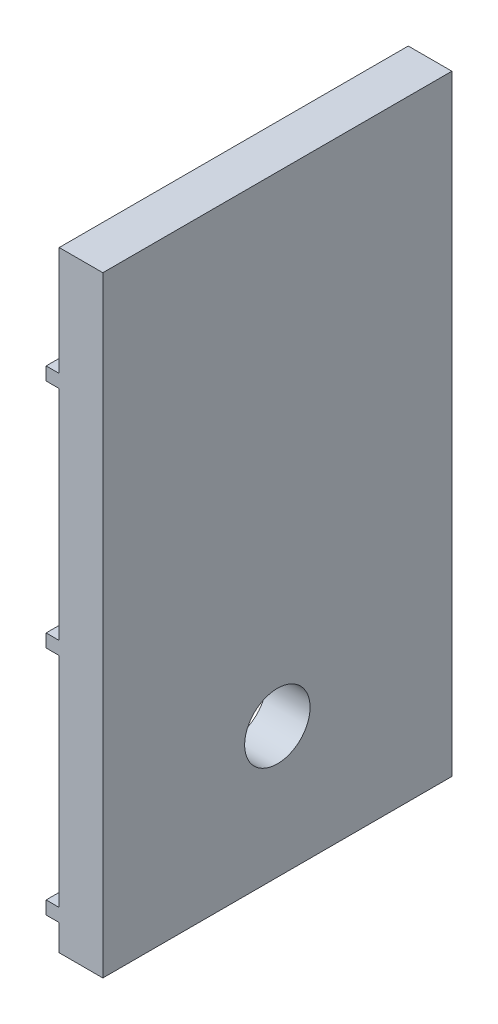
from build123d import *

# Parameters (mm, degrees)
BOSS_EXTRUDE1_DEPTH = 80
SKETCH2_R           = 7.5
CUT_EXTRUDE1_DEPTH  = 80


with BuildPart() as part:
    # Sketch1 → Boss-Extrude1 (new body)
    with BuildSketch(Plane.XY):
        Polygon((-10.10866575, -78.628610729), (-10.10866575, 61.371389271), (-20.10866575, 61.371389271), (-20.10866575, 36.371389271), (-23.10866575, 36.371389271), (-23.10866575, 33.371389271), (-20.10866575, 33.371389271), (-20.10866575, -16.628610729), (-23.10866575, -16.628610729), (-23.10866575, -19.628610729), (-20.10866575, -19.628610729), (-20.10866575, -69.628610729), (-23.10866575, -69.628610729), (-23.10866575, -72.628610729), (-20.10866575, -72.628610729), (-20.10866575, -78.628610729), align=None)
    extrude(amount=BOSS_EXTRUDE1_DEPTH)

    # Sketch2 → Cut-Extrude1 (cut)
    with BuildSketch(Plane.ZY.offset(20.10866575)):
        with Locations(Location((40, -48.628610729, 0), (0, 0, 270))):
            Circle(SKETCH2_R)
    extrude(amount=-CUT_EXTRUDE1_DEPTH, mode=Mode.SUBTRACT)


solid = part.part
